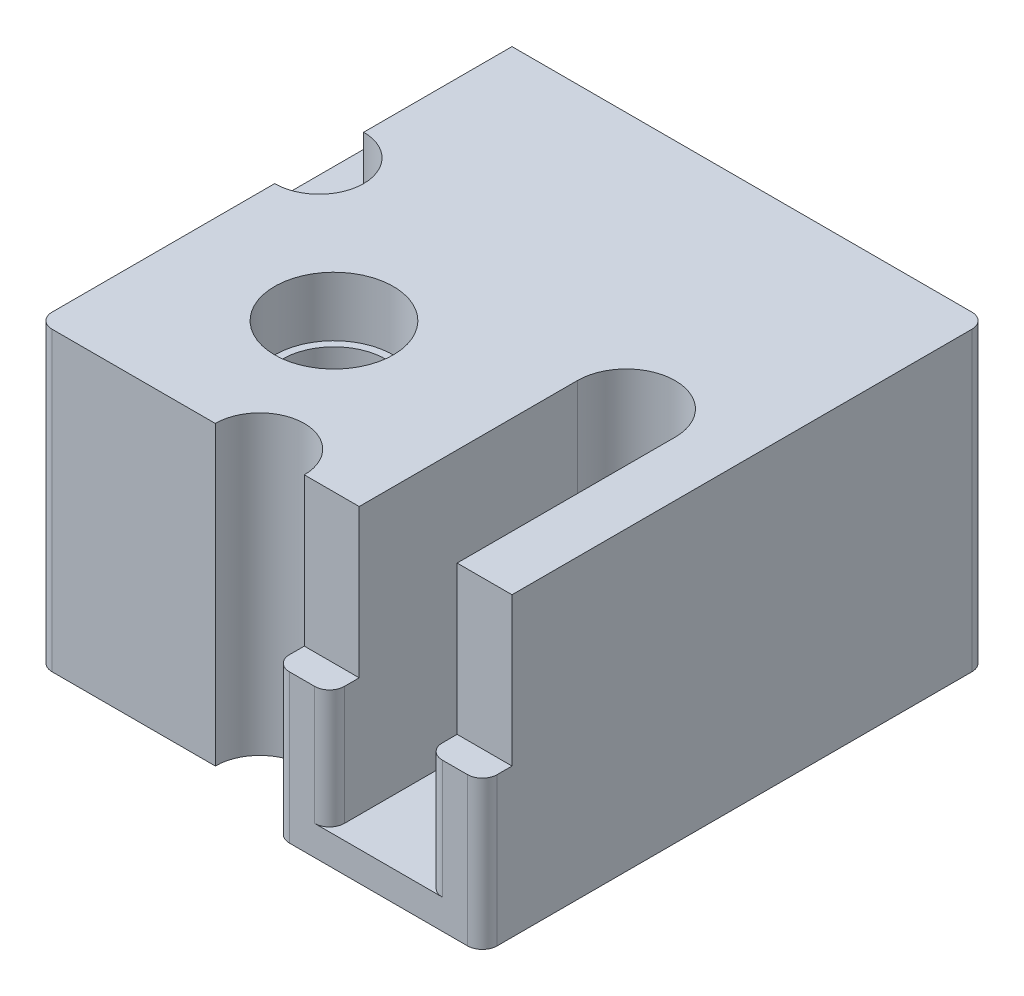
from build123d import *

# Parameters (mm, degrees)
BOSS_EXTRUDE1_DEPTH = 10
SKETCH4_R           = 1.75
CUT_EXTRUDE3_DEPTH  = 10
SKETCH6_R           = 2
CUT_EXTRUDE5_DEPTH  = 2
CUT_EXTRUDE6_DEPTH  = 29.447319733
SKETCH8_W           = 7
SKETCH8_H           = 1
SKETCH8_W_2         = 4.5
SKETCH8_H_2         = 5
CUT_EXTRUDE7_DEPTH  = 5
CUT_EXTRUDE8_DEPTH  = 9
FILLET6_R           = 0.5


with BuildPart() as part:
    # Sketch1 → Boss-Extrude1 (new body)
    with BuildSketch(Plane(origin=(0, 0, 0), x_dir=(1, 0, 0), z_dir=(0, 1, 0))):
        Polygon((0, 0), (20.5, 0), (20.5, -17), (13.5, -17), (13.5, -16), (4.5, -16), (4.5, -5), (0, -5), align=None)
    extrude(amount=BOSS_EXTRUDE1_DEPTH)

    # Sketch4 → Cut-Extrude3 (cut)
    with BuildSketch(Plane(origin=(0, 10, 0), x_dir=(1, 0, 0), z_dir=(0, 1, 0))):
        with Locations(Location((9.5, -11, 0), (0, 0, 270))):
            Circle(SKETCH4_R)
    extrude(amount=-CUT_EXTRUDE3_DEPTH, mode=Mode.SUBTRACT)

    # Sketch6 → Cut-Extrude5 (cut)
    with BuildSketch(Plane(origin=(0, 10, 0), x_dir=(1, 0, 0), z_dir=(0, 1, 0))):
        with Locations(Location((9.5, -11, 0), (0, 0, 270))):
            Circle(SKETCH6_R)
    extrude(amount=-CUT_EXTRUDE5_DEPTH, mode=Mode.SUBTRACT)

    # Sketch7 → Cut-Extrude6 (cut, through all)
    with BuildSketch(Plane.XZ):
        with BuildLine():
            Line((0, 8), (4.5, 8))
            ThreePointArc((4.5, 8), (6, 6.5), (4.5, 5))
            Line((4.5, 5), (0, 5))
            ThreePointArc((0, 5), (-1.5, 6.5), (0, 8))
        make_face()
        with BuildLine():
            Line((10.5, 16), (10.5, 17))
            ThreePointArc((10.5, 17), (12, 18.5), (13.5, 17))
            Line((13.5, 17), (13.5, 16))
            ThreePointArc((13.5, 16), (12, 14.5), (10.5, 16))
        make_face()
    extrude(amount=-CUT_EXTRUDE6_DEPTH, mode=Mode.SUBTRACT)

    # Sketch8 → Cut-Extrude7 (cut)
    with BuildSketch(Plane(origin=(0, 10, 0), x_dir=(1, 0, 0), z_dir=(0, 1, 0))):
        with Locations((17, -16.5)):
            Rectangle(SKETCH8_W, SKETCH8_H)
        with Locations((2.25, -2.5)):
            Rectangle(SKETCH8_W_2, SKETCH8_H_2)
    extrude(amount=-CUT_EXTRUDE7_DEPTH, mode=Mode.SUBTRACT)

    # Sketch9 → Cut-Extrude8 (cut)
    with BuildSketch(Plane(origin=(0, 10, 0), x_dir=(1, 0, 0), z_dir=(0, 1, 0))):
        with BuildLine():
            Line((15.35, -17), (15.35, -8.65))
            ThreePointArc((15.35, -8.65), (17, -7), (18.65, -8.65))
            Line((18.65, -8.65), (18.65, -17))
            ThreePointArc((18.65, -17), (17, -18.65), (15.35, -17))
        make_face()
    extrude(amount=-CUT_EXTRUDE8_DEPTH, mode=Mode.SUBTRACT)

    # Fillet6
    fillet6_edges = [part.edges().sort_by_distance(p)[0] for p in [
        (15.35, 3, 17),
        (18.65, 3, 17),
        (4.5, 5, 16),
        (20.5, 5, 0),
        (20.5, 2.5, 17),
        (13.5, 2.5, 17),
        (0, 2.5, 5),
        (0, 2.5, 0),
    ]]
    fillet(fillet6_edges, radius=FILLET6_R)


solid = part.part
